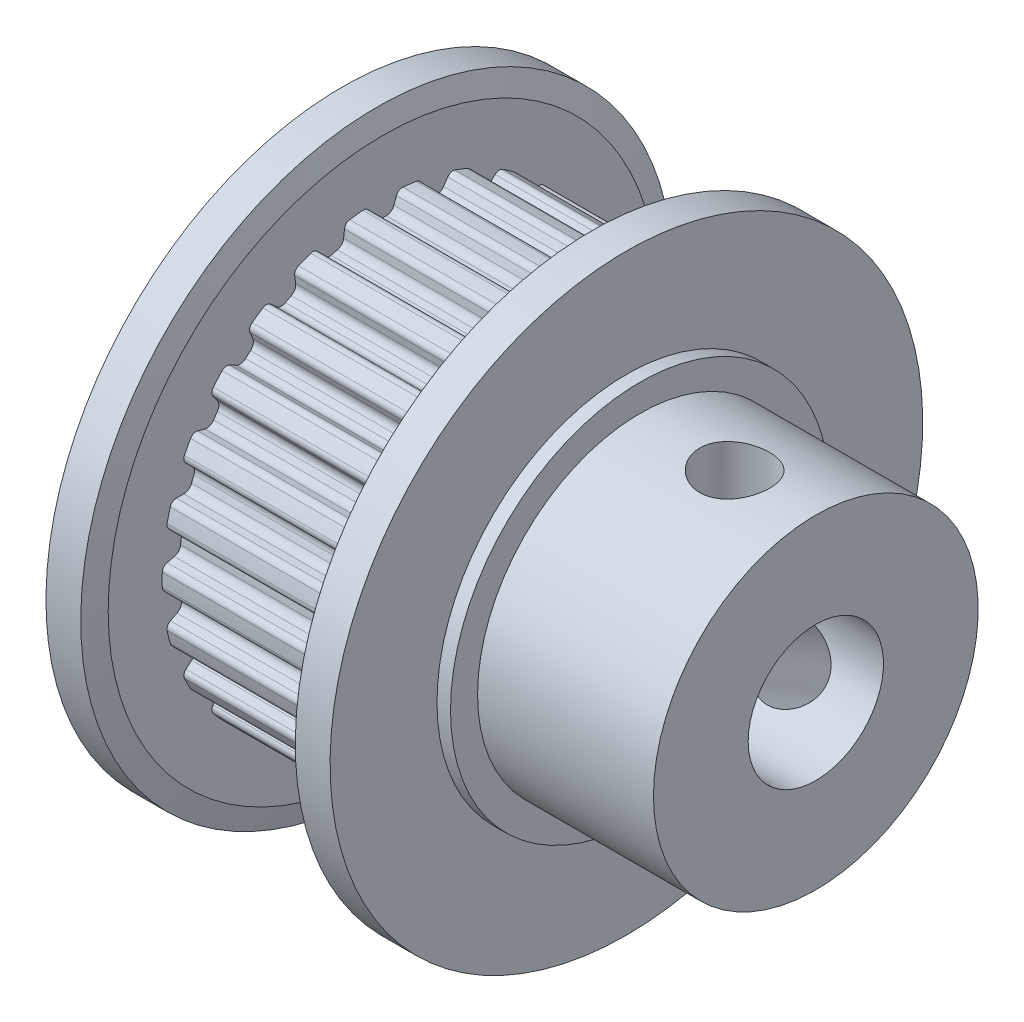
from build123d import *

# Parameters (mm, degrees)
CUT_EXTRUDE_3_DEPTH              = 3.75
FILLET_3_R                       = 0.23
FILLET_4_R                       = 0.3
PATTERN_CIRCULAR_2_COUNT         = 26
FILLET_3_OF_PATTERN_CIRCULAR_2_R = 0.23
FILLET_4_OF_PATTERN_CIRCULAR_2_R = 0.3
SKETCH_5_W                       = 6.5
SKETCH_5_H                       = 6
SKETCH_7_R                       = 2.5
CUT_EXTRUDE_4_DEPTH              = 24.744578329
SKETCH_31_R                      = 1.29
CUT_EXTRUDE_21_DEPTH             = 20.745062674
SKETCH_33_R                      = 1.29
CUT_EXTRUDE_22_DEPTH             = 20.745062736


with BuildPart() as part:
    # 草图1 → 旋转1 (revolve)
    with BuildSketch(Plane.XY, mode=Mode.PRIVATE) as revolve_1_sk:
        Polygon((-5.75, 7), (-3.75, 7), (-3.75, 8.155), (3.75, 8.155), (3.75, 7), (5.75, 7), (5.75, 0), (-5.75, 0), align=None)
    revolve(revolve_1_sk.sketch.rotate(Axis((-5.75, 0, 0), (1, 0, 0)), 90), axis=Axis((-5.75, 0, 0), (1, 0, 0)))

    # 草图3 → 切除-拉伸3 (cut, symmetric)
    with BuildSketch(Plane(origin=(0, 0, 0), x_dir=(0, 0, -1), z_dir=(1, 0, 0))):
        with BuildLine():
            Line((-0.335, 7.507529554), (-0.563563903, 8.135503717))
            ThreePointArc((-0.563563903, 8.135503717), (0, 8.155), (0.563563903, 8.135503717))
            Line((0.563563903, 8.135503717), (0.335, 7.507529554))
            ThreePointArc((0.335, 7.507529554), (0, 7.515), (-0.335, 7.507529554))
        make_face()
    cut_extrude_3 = extrude(amount=CUT_EXTRUDE_3_DEPTH, both=True, mode=Mode.SUBTRACT)

    # 圆角3
    fillet_3_edges = [part.edges().sort_by_distance(p)[0] for p in [
        (0, 8.135503717, 0.563563903),
        (0, 8.135503717, -0.563563903),
    ]]
    fillet(fillet_3_edges, radius=FILLET_3_R)

    # 圆角4
    fillet_4_edges = [part.edges().sort_by_distance(p)[0] for p in [
        (0, 7.507529554, -0.335),
        (0, 7.507529554, 0.335),
    ]]
    fillet(fillet_4_edges, radius=FILLET_4_R)

    # 阵列(圆周)2: 切除-拉伸3 ×26 about axis
    pattern_circular_2_axis = Axis((0, 0, 0), (1, 0, 0))
    for i in range(1, PATTERN_CIRCULAR_2_COUNT):
        add(cut_extrude_3.rotate(pattern_circular_2_axis, i * 360 / PATTERN_CIRCULAR_2_COUNT), mode=Mode.SUBTRACT)

    # 圆角3 of 阵列(圆周)2
    fillet_3_of_pattern_circular_2_edges = [part.edges().sort_by_distance(p)[0] for p in [
        (0, 7.764231095, 2.494141237),
        (0, 8.033970434, 1.399765716),
        (0, 6.941729583, 4.279768147),
        (0, 7.465531993, 3.281746039),
        (0, 5.71579998, 5.81667049),
        (0, 6.463223967, 4.973003212),
        (0, 4.157688859, 7.015529086),
        (0, 5.085296858, 6.375247514),
        (0, 2.357947973, 7.806670632),
        (0, 3.41183078, 7.406985603),
        (0, 0.421171722, 8.144116857),
        (0, 1.540081498, 8.008256613),
        (0, -1.540081498, 8.008256613),
        (0, -0.421171722, 8.144116857),
        (0, -3.41183078, 7.406985603),
        (0, -2.357947973, 7.806670632),
        (0, -5.085296858, 6.375247514),
        (0, -4.157688859, 7.015529086),
        (0, -6.463223967, 4.973003212),
        (0, -5.71579998, 5.81667049),
        (0, -7.465531993, 3.281746039),
        (0, -6.941729583, 4.279768147),
        (0, -8.033970434, 1.399765716),
        (0, -7.764231095, 2.494141237),
        (0, -8.135503717, -0.563563903),
        (0, -8.135503717, 0.563563903),
        (0, -7.764231095, -2.494141237),
        (0, -8.033970434, -1.399765716),
        (0, -6.941729583, -4.279768147),
        (0, -7.465531993, -3.281746039),
        (0, -5.71579998, -5.81667049),
        (0, -6.463223967, -4.973003212),
        (0, -4.157688859, -7.015529086),
        (0, -5.085296858, -6.375247514),
        (0, -2.357947973, -7.806670632),
        (0, -3.41183078, -7.406985603),
        (0, -0.421171722, -8.144116857),
        (0, -1.540081498, -8.008256613),
        (0, 1.540081498, -8.008256613),
        (0, 0.421171722, -8.144116857),
        (0, 3.41183078, -7.406985603),
        (0, 2.357947973, -7.806670632),
        (0, 5.085296858, -6.375247514),
        (0, 4.157688859, -7.015529086),
        (0, 6.463223967, -4.973003212),
        (0, 5.71579998, -5.81667049),
        (0, 7.465531993, -3.281746039),
        (0, 6.941729583, -4.279768147),
        (0, 8.033970434, -1.399765716),
        (0, 7.764231095, -2.494141237),
    ]]
    fillet(fillet_3_of_pattern_circular_2_edges, radius=FILLET_3_OF_PATTERN_CIRCULAR_2_R)

    # 圆角4 of 阵列(圆周)2
    fillet_4_of_pattern_circular_2_edges = [part.edges().sort_by_distance(p)[0] for p in [
        (0, 7.369545137, 1.471403913),
        (0, 7.209203642, 2.121934931),
        (0, 6.803269544, 3.19229518),
        (0, 6.491905018, 3.785550717),
        (0, 5.841612654, 4.727661854),
        (0, 5.397320473, 5.229164055),
        (0, 4.54046247, 5.988274005),
        (0, 3.989063279, 6.368877386),
        (0, 2.975437111, 6.900869438),
        (0, 2.348976228, 7.138454712),
        (0, 1.237490162, 7.412411423),
        (0, 0.572375217, 7.493170998),
        (0, -0.572375217, 7.493170998),
        (0, -1.237490162, 7.412411423),
        (0, -2.348976228, 7.138454712),
        (0, -2.975437111, 6.900869438),
        (0, -3.989063279, 6.368877386),
        (0, -4.54046247, 5.988274005),
        (0, -5.397320473, 5.229164055),
        (0, -5.841612654, 4.727661854),
        (0, -6.491905018, 3.785550717),
        (0, -6.803269544, 3.19229518),
        (0, -7.209203642, 2.121934931),
        (0, -7.369545137, 1.471403913),
        (0, -7.507529554, 0.335),
        (0, -7.507529554, -0.335),
        (0, -7.369545137, -1.471403913),
        (0, -7.209203642, -2.121934931),
        (0, -6.803269544, -3.19229518),
        (0, -6.491905018, -3.785550717),
        (0, -5.841612654, -4.727661854),
        (0, -5.397320473, -5.229164055),
        (0, -4.54046247, -5.988274005),
        (0, -3.989063279, -6.368877386),
        (0, -2.975437111, -6.900869438),
        (0, -2.348976228, -7.138454712),
        (0, -1.237490162, -7.412411423),
        (0, -0.572375217, -7.493170998),
        (0, 0.572375217, -7.493170998),
        (0, 1.237490162, -7.412411423),
        (0, 2.348976228, -7.138454712),
        (0, 2.975437111, -6.900869438),
        (0, 3.989063279, -6.368877386),
        (0, 4.54046247, -5.988274005),
        (0, 5.397320473, -5.229164055),
        (0, 5.841612654, -4.727661854),
        (0, 6.491905018, -3.785550717),
        (0, 6.803269544, -3.19229518),
        (0, 7.209203642, -2.121934931),
        (0, 7.369545137, -1.471403913),
    ]]
    fillet(fillet_4_of_pattern_circular_2_edges, radius=FILLET_4_OF_PATTERN_CIRCULAR_2_R)

    # 草图4 → 旋转2 (revolve)
    with BuildSketch(Plane.XY, mode=Mode.PRIVATE) as revolve_2_sk:
        Polygon((-5.25, 10.95), (-5.25, 7), (-3.75, 7), (-3.75, 10.15), (-3.964359354, 10.95), align=None)
        Polygon((5.25, 10.95), (5.25, 7), (3.75, 7), (3.75, 10.15), (3.964359354, 10.95), align=None)
    revolve(revolve_2_sk.sketch.rotate(Axis((-5.75, 0, 0), (1, 0, 0)), 180), axis=Axis((-5.75, 0, 0), (1, 0, 0)))

    # 草图5 → 旋转3 (revolve)
    with BuildSketch(Plane.XY, mode=Mode.PRIVATE) as revolve_3_sk:
        with Locations((9, 3)):
            Rectangle(SKETCH_5_W, SKETCH_5_H)
    revolve(revolve_3_sk.sketch.rotate(Axis((5.75, 0, 0), (1, 0, 0)), 90), axis=Axis((5.75, 0, 0), (1, 0, 0)))

    # 草图7 → 切除-拉伸4 (cut, through all)
    with BuildSketch(Plane.ZY.offset(5.75)):
        Circle(SKETCH_7_R)
    extrude(amount=-CUT_EXTRUDE_4_DEPTH, mode=Mode.SUBTRACT)

    # 草图31 → 切除-拉伸21 (cut, through all)
    with BuildSketch(Plane(origin=(0, 0, 0), x_dir=(1, 0, 0), z_dir=(0, 1, 0))):
        with Locations(Location((9.25, 0, 0), (0, 0, 90))):
            Circle(SKETCH_31_R)
    extrude(amount=CUT_EXTRUDE_21_DEPTH, mode=Mode.SUBTRACT)

    # 草图33 → 切除-拉伸22 (cut, through all)
    with BuildSketch(Plane(origin=(0, 0, 0), x_dir=(1, 0, 0), z_dir=(0, -0.49999999999999983, -0.8660254037844388))):
        with Locations(Location((9.25, 0, 0), (0, 0, 90))):
            Circle(SKETCH_33_R)
    extrude(amount=CUT_EXTRUDE_22_DEPTH, mode=Mode.SUBTRACT)


solid = part.part
